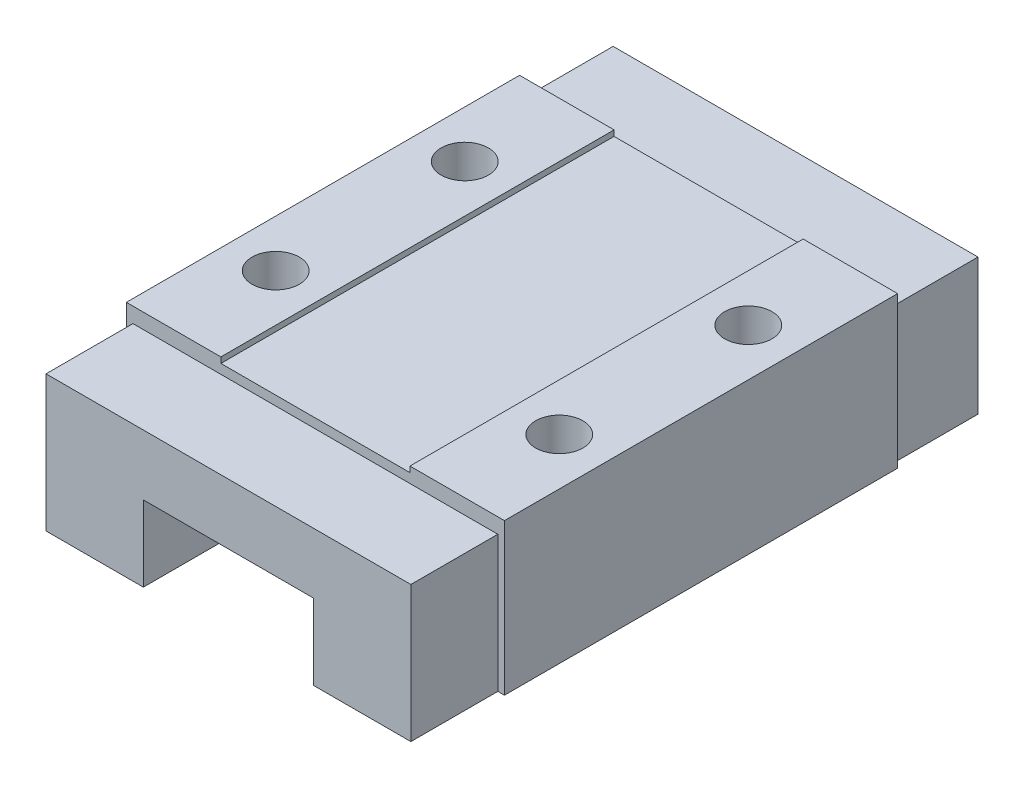
from build123d import *

# Parameters (mm, degrees)
BOSS_EXTRUDE1_DEPTH         = 10.4
BOSS_EXTRUDE2_DEPTH         = 15
TAP_DRILL_FOR_M3_TAP1_D     = 2.5
TAP_DRILL_FOR_M3_TAP1_DEPTH = 3
TAP_DRILL_FOR_M3_TAP1_TIP   = 0.751075774


with BuildPart() as part:
    # Sketch1 → Boss-Extrude1 (new, symmetric)
    with BuildSketch(Plane.XY):
        Polygon((-10, 0), (-5, 0), (-5, -0.3), (5, -0.3), (5, 0), (10, 0), (10, -8), (4.5, -8), (4.5, -4), (-4.5, -4), (-4.5, -8), (-10, -8), align=None)
    extrude(amount=BOSS_EXTRUDE1_DEPTH, both=True)

    # Sketch2 → Boss-Extrude2 (add, symmetric)
    with BuildSketch(Plane.XY):
        Polygon((-9.65, -0.8), (9.65, -0.8), (9.65, -8), (4.5, -8), (4.5, -4), (-4.5, -4), (-4.5, -8), (-9.65, -8), align=None)
    extrude(amount=BOSS_EXTRUDE2_DEPTH, both=True)

    # Tap Drill for M3 Tap1
    with Locations(Plane(origin=(0, 0, 0), x_dir=(1, 0, 0), z_dir=(0, 1, 0))):
        with Locations((7.5, 5), (7.5, -5), (-7.5, 5), (-7.5, -5)):
            Hole(TAP_DRILL_FOR_M3_TAP1_D / 2, depth=TAP_DRILL_FOR_M3_TAP1_DEPTH)
            with Locations((0, 0, -(TAP_DRILL_FOR_M3_TAP1_DEPTH + TAP_DRILL_FOR_M3_TAP1_TIP / 2))):  # 118° drill point
                Cone(0, TAP_DRILL_FOR_M3_TAP1_D / 2, TAP_DRILL_FOR_M3_TAP1_TIP, mode=Mode.SUBTRACT)


solid = part.part
